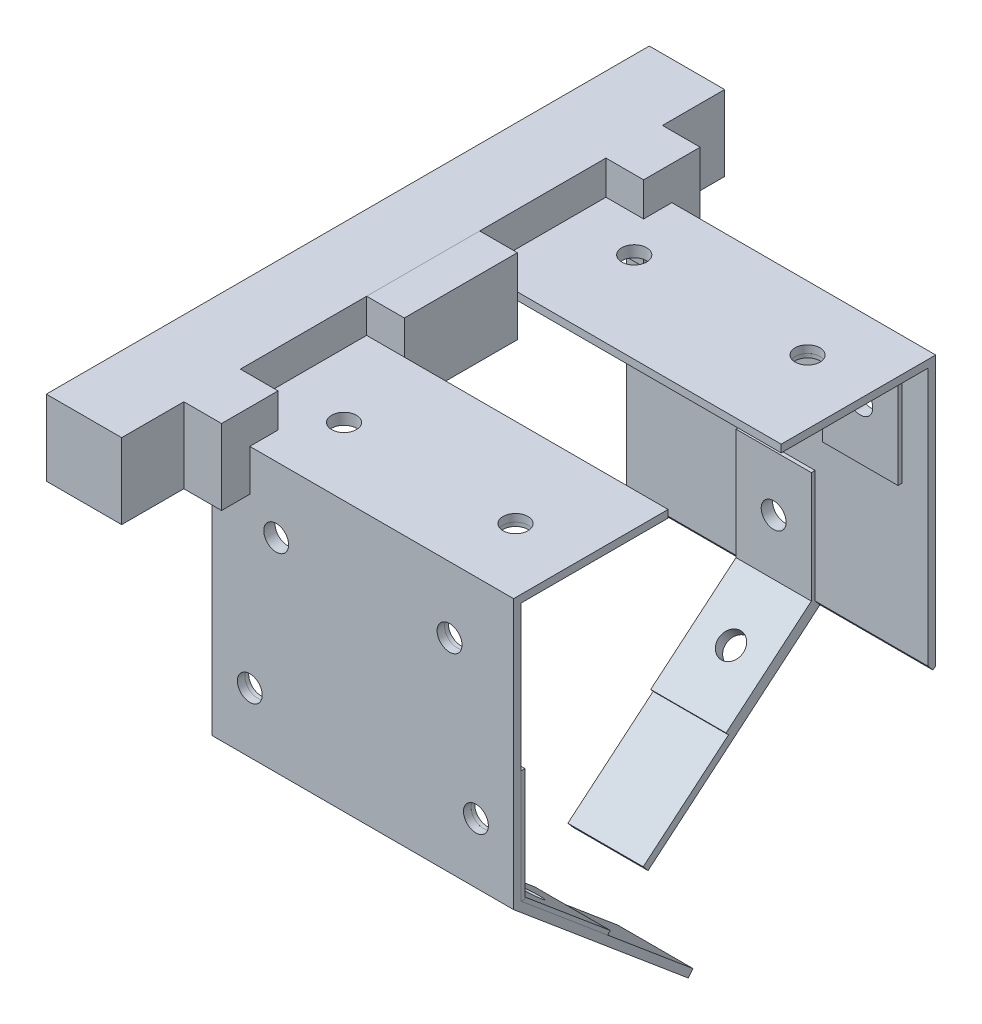
from build123d import *

# Parameters (mm, degrees)
EXTRUDE_THIN1_DEPTH   = 101.6
EXTRUDE_THIN1_2_DEPTH = 101.6
SKETCH6_W             = 38.1
SKETCH6_H             = 75.607789274
CUT_EXTRUDE2_DEPTH    = 11.684
SKETCH7_W             = 50.8
SKETCH7_H             = 75.607789274
CUT_EXTRUDE3_DEPTH    = 11.684
SKETCH8_W             = 25.4
SKETCH8_H             = 38.1
BOSS_EXTRUDE1_DEPTH   = 1.27
BOSS_EXTRUDE1_2_DEPTH = 1.27
BOSS_EXTRUDE1_3_DEPTH = 1.27
BOSS_EXTRUDE1_4_DEPTH = 1.27
SKETCH10_W            = 25.4
SKETCH10_H            = 38.1
BOSS_EXTRUDE2_DEPTH   = 1.27
BOSS_EXTRUDE2_2_DEPTH = 1.27
SKETCH12_W            = 25.4
SKETCH12_H            = 38.1
BOSS_EXTRUDE3_DEPTH   = 1.27
SKETCH13_W            = 25.4
SKETCH13_H            = 38.1
BOSS_EXTRUDE4_DEPTH   = 1.27
SKETCH14_W            = 25.4
SKETCH14_H            = 38.1
BOSS_EXTRUDE5_DEPTH   = 1.27
BOSS_EXTRUDE5_2_DEPTH = 1.27
BOSS_EXTRUDE5_3_DEPTH = 1.27
BOSS_EXTRUDE5_4_DEPTH = 1.27
SKETCH18_R            = 4.191
CUT_EXTRUDE4_DEPTH    = 34.798
CUT_EXTRUDE5_START    = -201.168
SKETCH20_R            = 4.191
CUT_EXTRUDE5_DEPTH    = 201.168
SKETCH23_R            = 4.191
CUT_EXTRUDE6_DEPTH    = 201.168
SKETCH24_R            = 4.191
CUT_EXTRUDE7_DEPTH    = 201.168
SKETCH25_R            = 4.191
CUT_EXTRUDE8_DEPTH    = 201.168
SKETCH26_R            = 4.191
CUT_EXTRUDE9_DEPTH    = 201.168
SKETCH27_W            = 203.2
SKETCH27_H            = 25.4
BOSS_EXTRUDE6_DEPTH   = 25.4
SKETCH28_W            = 38.1
SKETCH28_H            = 25.4
BOSS_EXTRUDE7_DEPTH   = 12.7
SKETCH29_W            = 19.05
SKETCH29_H            = 25.4
BOSS_EXTRUDE8_DEPTH   = 12.7


with BuildPart() as part:
    # Sketch2 → Extrude-Thin1 (new body)
    with BuildSketch(Plane(origin=(0, 0, 0), x_dir=(0, 0, -1), z_dir=(1, 0, 0))):
        Polygon((-19.05, 1.27), (-71.12, 1.27), (-71.12, -89.492210726), (-12.293753699, -138.853292301), (-10.66107317, -136.907539415), (-68.58, -88.307789274), (-68.58, -1.27), (-19.05, -1.27), align=None)
    extrude(amount=EXTRUDE_THIN1_DEPTH)

    # Sketch7 → Cut-Extrude3 (cut)
    with BuildSketch(Plane(origin=(0, -85.590195828, 71.818701752), x_dir=(1, 0, 0), z_dir=(0, 0.7660444431189803, -0.6427876096865368))):
        with Locations((50.8, 42.031719512)):
            Rectangle(SKETCH7_W, SKETCH7_H)
    extrude(amount=-CUT_EXTRUDE3_DEPTH, mode=Mode.SUBTRACT)


with BuildPart() as body_2:
    # Sketch2 → Extrude-Thin1 2 (new body)
    with BuildSketch(Plane(origin=(0, 0, 0), x_dir=(0, 0, -1), z_dir=(1, 0, 0))):
        Polygon((19.05, -1.27), (68.58, -1.27), (68.58, -88.307789274), (10.66107317, -136.907539415), (12.293753699, -138.853292301), (71.12, -89.492210726), (71.12, 1.27), (19.05, 1.27), align=None)
    extrude(amount=EXTRUDE_THIN1_2_DEPTH)

    # Sketch6 → Cut-Extrude2 (cut)
    with BuildSketch(Plane(origin=(0, -85.590195828, -71.818701752), x_dir=(1, 0, 0), z_dir=(0, 0.7660444431189795, 0.6427876096865376))):
        with Locations((82.55, -42.031719512)):
            Rectangle(SKETCH6_W, SKETCH6_H)
        with Locations((19.05, -42.031719512)):
            Rectangle(SKETCH6_W, SKETCH6_H)
    extrude(amount=-CUT_EXTRUDE2_DEPTH, mode=Mode.SUBTRACT)



with BuildPart() as body_3:
    # Sketch8 → Boss-Extrude1 (new body)
    with BuildSketch(Plane(origin=(0, 0, 68.58), x_dir=(-1, 0, 0), z_dir=(0, 0, -1))):
        with Locations((-88.9, -69.257789274)):
            Rectangle(SKETCH8_W, SKETCH8_H)
    extrude(amount=BOSS_EXTRUDE1_DEPTH)


with BuildPart() as body_4:
    # Sketch8 → Boss-Extrude1 2 (new body)
    with BuildSketch(Plane(origin=(0, 0, 68.58), x_dir=(-1, 0, 0), z_dir=(0, 0, -1))):
        with Locations((-12.7, -69.257789274)):
            Rectangle(SKETCH8_W, SKETCH8_H)
    extrude(amount=BOSS_EXTRUDE1_2_DEPTH)


with BuildPart() as body_5:
    # Sketch8 → Boss-Extrude1 3 (new body)
    with BuildSketch(Plane(origin=(0, 0, 68.58), x_dir=(-1, 0, 0), z_dir=(0, 0, -1))):
        with Locations((-80.01, -20.32)):
            Rectangle(SKETCH8_W, SKETCH8_H)
    extrude(amount=BOSS_EXTRUDE1_3_DEPTH)


with BuildPart() as body_6:
    # Sketch8 → Boss-Extrude1 4 (new body)
    with BuildSketch(Plane(origin=(0, 0, 68.58), x_dir=(-1, 0, 0), z_dir=(0, 0, -1))):
        with Locations((-21.59, -20.32)):
            Rectangle(SKETCH8_W, SKETCH8_H)
    extrude(amount=BOSS_EXTRUDE1_4_DEPTH)


with BuildPart() as body_7:
    # Sketch10 → Boss-Extrude2 (new body)
    with BuildSketch(Plane(origin=(0, -85.590195828, 71.818701752), x_dir=(1, 0, 0), z_dir=(0, 0.7660444431189803, -0.6427876096865368))):
        with Locations((88.9, 23.277824875)):
            Rectangle(SKETCH10_W, SKETCH10_H)
    extrude(amount=BOSS_EXTRUDE2_DEPTH)


with BuildPart() as body_8:
    # Sketch10 → Boss-Extrude2 2 (new body)
    with BuildSketch(Plane(origin=(0, -85.590195828, 71.818701752), x_dir=(1, 0, 0), z_dir=(0, 0.7660444431189803, -0.6427876096865368))):
        with Locations((12.7, 23.277824875)):
            Rectangle(SKETCH10_W, SKETCH10_H)
    extrude(amount=BOSS_EXTRUDE2_2_DEPTH)


with BuildPart() as body_9:
    # Sketch12 → Boss-Extrude3 (new body)
    with BuildSketch(Plane(origin=(0, -85.590195828, -71.818701752), x_dir=(1, 0, 0), z_dir=(0, 0.7660444431189795, 0.6427876096865376))):
        with Locations((50.8, -23.277824875)):
            Rectangle(SKETCH12_W, SKETCH12_H)
    extrude(amount=BOSS_EXTRUDE3_DEPTH)


with BuildPart() as body_2_1:
    add(body_2.part)

    add(body_9.part)  # Boss-Extrude4 merges body 9
    # Sketch13 → Boss-Extrude4 (add)
    with BuildSketch(Plane.XY.offset(-68.58)):
        with Locations((50.8, -69.257789274)):
            Rectangle(SKETCH13_W, SKETCH13_H)
        with Locations((80.01, -20.32)):
            Rectangle(SKETCH13_W, SKETCH13_H)
        with Locations((21.59, -20.32)):
            Rectangle(SKETCH13_W, SKETCH13_H)
    extrude(amount=BOSS_EXTRUDE4_DEPTH)

    # Sketch20 → Cut-Extrude5 (cut)
    with BuildSketch(Plane.XY.offset(71.12).offset(CUT_EXTRUDE5_START)):
        with Locations(Location((21.59, -20.955, 0), (0, 0, 180))):
            Circle(SKETCH20_R)
        with Locations(Location((80.01, -20.955, 0), (0, 0, 180))):
            Circle(SKETCH20_R)
    extrude(amount=CUT_EXTRUDE5_DEPTH, mode=Mode.SUBTRACT)


with BuildPart() as body_9_2:
    # Sketch14 → Boss-Extrude5 (new body)
    with BuildSketch(Plane.XZ.offset(1.27)):
        with Locations((21.59, 48.26)):
            Rectangle(SKETCH14_W, SKETCH14_H)
    extrude(amount=BOSS_EXTRUDE5_DEPTH)


with BuildPart() as body_10:
    # Sketch14 → Boss-Extrude5 2 (new body)
    with BuildSketch(Plane.XZ.offset(1.27)):
        with Locations((80.01, 49.53)):
            Rectangle(SKETCH14_W, SKETCH14_H)
    extrude(amount=BOSS_EXTRUDE5_2_DEPTH)


with BuildPart() as body_11:
    # Sketch14 → Boss-Extrude5 3 (new body)
    with BuildSketch(Plane.XZ.offset(1.27)):
        with Locations((80.01, -49.53)):
            Rectangle(SKETCH14_W, SKETCH14_H)
    extrude(amount=BOSS_EXTRUDE5_3_DEPTH)


with BuildPart() as body_12:
    # Sketch14 → Boss-Extrude5 4 (new body)
    with BuildSketch(Plane.XZ.offset(1.27)):
        with Locations((21.59, -49.53)):
            Rectangle(SKETCH14_W, SKETCH14_H)
    extrude(amount=BOSS_EXTRUDE5_4_DEPTH)


with BuildPart() as cut_extrude4_tool:
    # Sketch18 → Cut-Extrude4 (new body)
    with BuildSketch(Plane(origin=(0, 0, 67.31), x_dir=(-1, 0, 0), z_dir=(0, 0, -1))):
        with Locations((-80.01, -20.955)):
            Circle(SKETCH18_R)
        with Locations((-21.59, -20.955)):
            Circle(SKETCH18_R)
        with Locations((-12.7, -69.257789274)):
            Circle(SKETCH18_R)
        with Locations((-88.9, -69.257789274)):
            Circle(SKETCH18_R)
    extrude(amount=-CUT_EXTRUDE4_DEPTH)


with BuildPart() as part_1:
    add(part.part)

    # Cut-Extrude4: cut by cut_extrude4_tool
    add(cut_extrude4_tool.part, mode=Mode.SUBTRACT)


with BuildPart() as body_3_1:
    add(body_3.part)

    # Cut-Extrude4: cut by cut_extrude4_tool
    add(cut_extrude4_tool.part, mode=Mode.SUBTRACT)


with BuildPart() as body_4_1:
    add(body_4.part)

    # Cut-Extrude4: cut by cut_extrude4_tool
    add(cut_extrude4_tool.part, mode=Mode.SUBTRACT)


with BuildPart() as body_5_1:
    add(body_5.part)

    # Cut-Extrude4: cut by cut_extrude4_tool
    add(cut_extrude4_tool.part, mode=Mode.SUBTRACT)


with BuildPart() as body_6_1:
    add(body_6.part)

    # Cut-Extrude4: cut by cut_extrude4_tool
    add(cut_extrude4_tool.part, mode=Mode.SUBTRACT)


with BuildPart() as cut_extrude6_tool:
    # Sketch23 → Cut-Extrude6 (new body)
    with BuildSketch(Plane.XZ.offset(2.54)):
        with Locations(Location((80.01, -49.53, 0), (0, 0, 270))):
            Circle(SKETCH23_R)
        with Locations(Location((21.59, -49.53, 0), (0, 0, 270))):
            Circle(SKETCH23_R)
        with Locations(Location((80.01, 48.895, 0), (0, 0, 270))):
            Circle(SKETCH23_R)
        with Locations(Location((21.59, 48.26, 0), (0, 0, 270))):
            Circle(SKETCH23_R)
    extrude(amount=-CUT_EXTRUDE6_DEPTH)


with BuildPart() as part_2:
    add(part_1.part)

    # Cut-Extrude6: cut by cut_extrude6_tool
    add(cut_extrude6_tool.part, mode=Mode.SUBTRACT)


with BuildPart() as body_2_2:
    add(body_2_1.part)

    # Cut-Extrude6: cut by cut_extrude6_tool
    add(cut_extrude6_tool.part, mode=Mode.SUBTRACT)

    # Sketch24 → Cut-Extrude7 (cut)
    with BuildSketch(Plane.XY.offset(-67.31)):
        with Locations((50.8, -68.961683911)):
            Circle(SKETCH24_R)
    extrude(amount=-CUT_EXTRUDE7_DEPTH, mode=Mode.SUBTRACT)

    # Sketch26 → Cut-Extrude9 (cut)
    with BuildSketch(Plane(origin=(0, -84.617319386, -71.002361488), x_dir=(1, 0, 0), z_dir=(0, 0.7660444431189795, 0.6427876096865376))):
        with Locations(Location((50.8, -23.573930238, 0), (0, 0, 270))):
            Circle(SKETCH26_R)
    extrude(amount=-CUT_EXTRUDE9_DEPTH, mode=Mode.SUBTRACT)


with BuildPart() as body_9_2_1:
    add(body_9_2.part)

    # Cut-Extrude6: cut by cut_extrude6_tool
    add(cut_extrude6_tool.part, mode=Mode.SUBTRACT)


with BuildPart() as body_10_1:
    add(body_10.part)

    # Cut-Extrude6: cut by cut_extrude6_tool
    add(cut_extrude6_tool.part, mode=Mode.SUBTRACT)


with BuildPart() as body_11_1:
    add(body_11.part)

    # Cut-Extrude6: cut by cut_extrude6_tool
    add(cut_extrude6_tool.part, mode=Mode.SUBTRACT)


with BuildPart() as body_12_1:
    add(body_12.part)

    # Cut-Extrude6: cut by cut_extrude6_tool
    add(cut_extrude6_tool.part, mode=Mode.SUBTRACT)


with BuildPart() as cut_extrude8_tool:
    # Sketch25 → Cut-Extrude8 (new body)
    with BuildSketch(Plane(origin=(0, -84.617319386, 71.002361488), x_dir=(1, 0, 0), z_dir=(0, 0.7660444431189802, -0.6427876096865367))):
        with Locations(Location((12.7, 23.277824875, 0), (0, 0, 270))):
            Circle(SKETCH25_R)
        with Locations(Location((88.9, 23.277824875, 0), (0, 0, 270))):
            Circle(SKETCH25_R)
    extrude(amount=-CUT_EXTRUDE8_DEPTH)


with BuildPart() as part_3:
    add(part_2.part)

    # Cut-Extrude8: cut by cut_extrude8_tool
    add(cut_extrude8_tool.part, mode=Mode.SUBTRACT)


    add(body_2_2.part)  # Boss-Extrude6 merges body 2
    # Sketch27 → Boss-Extrude6 (add)
    with BuildSketch(Plane(origin=(0, 0, 0), x_dir=(0, 0, -1), z_dir=(1, 0, 0))):
        Rectangle(SKETCH27_W, SKETCH27_H)
    extrude(amount=-BOSS_EXTRUDE6_DEPTH)


    add(body_6_1.part)  # Boss-Extrude8 merges body 6

    add(body_9_2_1.part)  # Boss-Extrude8 merges body 9 2

    add(body_12_1.part)  # Boss-Extrude8 merges body 12
    # Sketch29 → Boss-Extrude8 (add)
    with BuildSketch(Plane(origin=(0, 0, 0), x_dir=(0, 0, -1), z_dir=(1, 0, 0))):
        with Locations((-71.12, 0)):
            Rectangle(SKETCH29_W, SKETCH29_H)
        with Locations((71.12, 0)):
            Rectangle(SKETCH29_W, SKETCH29_H)
    extrude(amount=BOSS_EXTRUDE8_DEPTH)


with BuildPart() as body_7_1:
    add(body_7.part)

    # Cut-Extrude8: cut by cut_extrude8_tool
    add(cut_extrude8_tool.part, mode=Mode.SUBTRACT)


with BuildPart() as body_8_1:
    add(body_8.part)

    # Cut-Extrude8: cut by cut_extrude8_tool
    add(cut_extrude8_tool.part, mode=Mode.SUBTRACT)


with BuildPart() as body_12_2:
    # Sketch28 → Boss-Extrude7 (new body)
    with BuildSketch(Plane(origin=(0, 0, 0), x_dir=(0, 0, -1), z_dir=(1, 0, 0))):
        Rectangle(SKETCH28_W, SKETCH28_H)
    extrude(amount=BOSS_EXTRUDE7_DEPTH)


solid = Compound([body_3_1.part, body_4_1.part, body_5_1.part, body_10_1.part, body_11_1.part, part_3.part, body_7_1.part, body_8_1.part, body_12_2.part])
